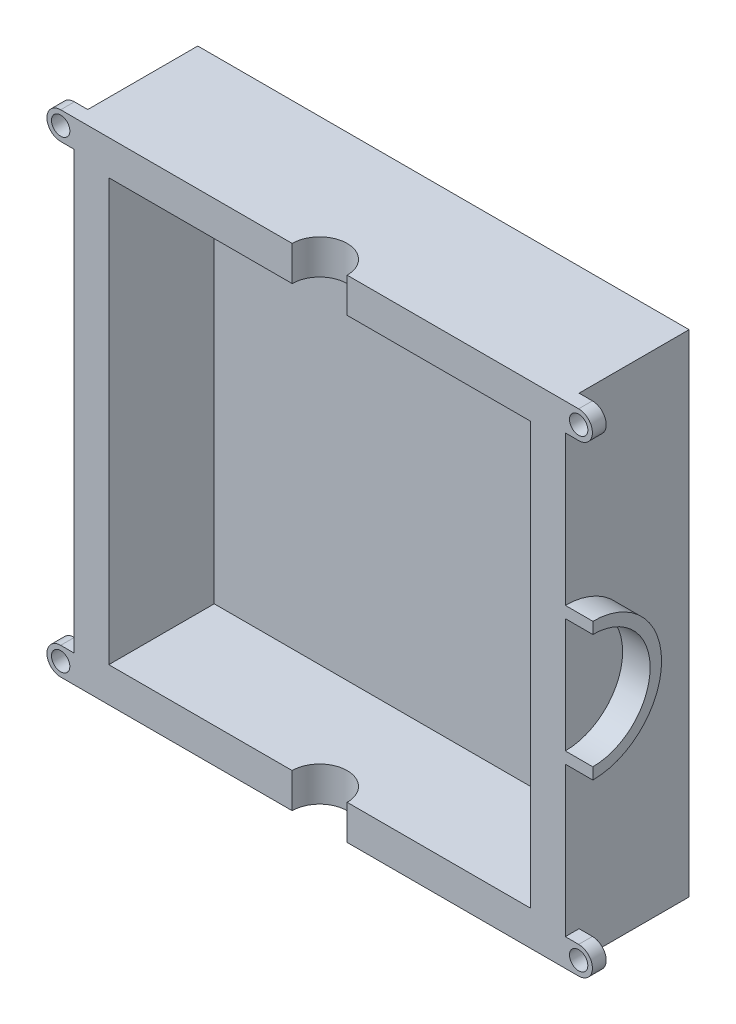
from build123d import *

# Parameters (mm, degrees)
SKETCH_1_W          = 107.18
SKETCH_1_H          = 107.18
EXTRUDE_1_DEPTH     = 27
SKETCH_2_W          = 92
SKETCH_2_H          = 92
CUT_EXTRUDE_1_DEPTH = 23
SKETCH_3_R          = 6
CUT_EXTRUDE_2_DEPTH = 123.835013331
EXTRUDE_3_DEPTH     = 6
SKETCH_7_R          = 2
EXTRUDE_4_DEPTH     = 3


with BuildPart() as part:
    # 草图1 → 凸台-拉伸1 (new body)
    with BuildSketch(Plane.XY):
        Rectangle(SKETCH_1_W, SKETCH_1_H)
    extrude(amount=EXTRUDE_1_DEPTH)

    # 草图2 → 切除-拉伸1 (cut)
    with BuildSketch(Plane.XY.offset(27)):
        Rectangle(SKETCH_2_W, SKETCH_2_H)
    extrude(amount=-CUT_EXTRUDE_1_DEPTH, mode=Mode.SUBTRACT)

    # 草图3 → 切除-拉伸2 (cut, through all)
    with BuildSketch(Plane(origin=(0, 53.59, 0), x_dir=(1, 0, 0), z_dir=(0, 1, 0))):
        with Locations((0, -27)):
            Circle(SKETCH_3_R)
    extrude(amount=-CUT_EXTRUDE_2_DEPTH, mode=Mode.SUBTRACT)

    # 草图5 → 凸台-拉伸3 (add)
    with BuildSketch(Plane(origin=(53.59, 0, 0), x_dir=(0, 0, -1), z_dir=(1, 0, 0))):
        with BuildLine():
            ThreePointArc((-27, -15), (-12, 0), (-27, 15))
            Line((-27, 15), (-27, 12.5))
            ThreePointArc((-27, 12.5), (-14.5, 0), (-27, -12.5))
            Line((-27, -12.5), (-27, -15))
        make_face()
    extrude(amount=EXTRUDE_3_DEPTH)

    # 草图7 → 凸台-拉伸4 (add)
    # profile 1 of 4: a face of its own
    with BuildSketch(Plane.XY.offset(27)):
        with BuildLine():
            Line((-56.5, 53.59), (-49.473493433, 53.59))
            Line((-49.473493433, 53.59), (-49.473493433, 47.59))
            Line((-49.473493433, 47.59), (-56.5, 47.59))
            ThreePointArc((-56.5, 47.59), (-59.5, 50.59), (-56.5, 53.59))
        make_face()
        with Locations((-56.5, 50.59)):
            Circle(SKETCH_7_R, mode=Mode.SUBTRACT)
    # profile 2 of 4: a face of its own
    with BuildSketch(Plane.XY.offset(27)):
        with BuildLine():
            Line((51.172302286, 53.59), (56.5, 53.59))
            ThreePointArc((56.5, 53.59), (59.5, 50.59), (56.5, 47.59))
            Line((56.5, 47.59), (51.172302286, 47.59))
            Line((51.172302286, 47.59), (51.172302286, 53.59))
        make_face()
        with Locations((56.5, 50.59)):
            Circle(SKETCH_7_R, mode=Mode.SUBTRACT)
    # profile 3 of 4: a face of its own
    with BuildSketch(Plane.XY.offset(27)):
        with BuildLine():
            Line((51.172302286, -47.59), (56.5, -47.59))
            ThreePointArc((56.5, -47.59), (59.5, -50.59), (56.5, -53.59))
            Line((56.5, -53.59), (51.172302286, -53.59))
            Line((51.172302286, -53.59), (51.172302286, -47.59))
        make_face()
        with Locations(Location((56.5, -50.59, 0), (0, 0, 180))):
            Circle(SKETCH_7_R, mode=Mode.SUBTRACT)
    # profile 4 of 4: a face of its own
    with BuildSketch(Plane.XY.offset(27)):
        with BuildLine():
            Line((-49.473493433, -53.59), (-49.473493433, -47.59))
            Line((-49.473493433, -47.59), (-56.5, -47.59))
            ThreePointArc((-56.5, -47.59), (-59.5, -50.59), (-56.5, -53.59))
            Line((-56.5, -53.59), (-49.473493433, -53.59))
        make_face()
        with Locations(Location((-56.5, -50.59, 0), (0, 0, 180))):
            Circle(SKETCH_7_R, mode=Mode.SUBTRACT)
    extrude(amount=-EXTRUDE_4_DEPTH)


solid = part.part
